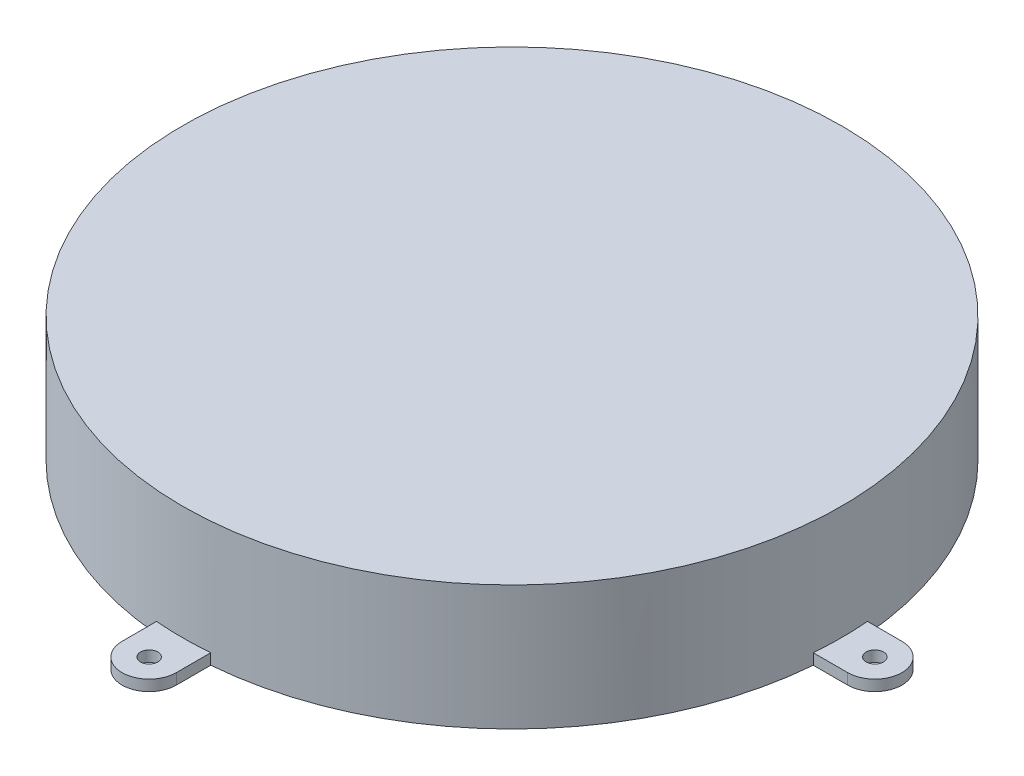
from build123d import *

# Parameters (mm, degrees)
SKETCH1_R           = 60.75
SKETCH1_R_2         = 59.75
BOSS_EXTRUDE1_DEPTH = 21
SKETCH2_R           = 60.75
BOSS_EXTRUDE2_DEPTH = 2
SKETCH3_R           = 1.6
BOSS_EXTRUDE3_DEPTH = 2


with BuildPart() as part:
    # Sketch1 → Boss-Extrude1 (new body)
    with BuildSketch(Plane(origin=(0, 0, 0), x_dir=(1, 0, 0), z_dir=(0, 1, 0))):
        with Locations(Location((0, 0, 0), (0, 0, 90))):
            Circle(SKETCH1_R)
        with Locations(Location((0, 0, 0), (0, 0, 90))):
            Circle(SKETCH1_R_2, mode=Mode.SUBTRACT)
    extrude(amount=BOSS_EXTRUDE1_DEPTH)

    # Sketch2 → Boss-Extrude2 (add)
    with BuildSketch(Plane(origin=(0, 21, 0), x_dir=(1, 0, 0), z_dir=(0, 1, 0))):
        with Locations(Location((0, 0, 0), (0, 0, 90))):
            Circle(SKETCH2_R)
    extrude(amount=BOSS_EXTRUDE2_DEPTH)

    # Sketch3 → Boss-Extrude3 (add)
    # profile 1 of 4: a face of its own
    with BuildSketch(Plane(origin=(0, 0, 0), x_dir=(1, 0, 0), z_dir=(0, 1, 0))):
        with BuildLine():
            Line((5, 66.893889039), (5, 60.543889039))
            Line((5, 60.543889039), (-5, 60.543889039))
            Line((-5, 60.543889039), (-5, 66.893889039))
            ThreePointArc((-5, 66.893889039), (0, 71.893889039), (5, 66.893889039))
        make_face()
        with Locations(Location((0, 66.893889039, 0), (0, 0, 270))):
            Circle(SKETCH3_R, mode=Mode.SUBTRACT)
    # profile 2 of 4: a face of its own
    with BuildSketch(Plane(origin=(0, 0, 0), x_dir=(1, 0, 0), z_dir=(0, 1, 0))):
        with BuildLine():
            Line((60.543889039, 5), (66.893889039, 5))
            ThreePointArc((66.893889039, 5), (71.893889039, 0), (66.893889039, -5))
            Line((66.893889039, -5), (60.543889039, -5))
            Line((60.543889039, -5), (60.543889039, 5))
        make_face()
        with Locations(Location((66.893889039, 0, 0), (0, 0, 270))):
            Circle(SKETCH3_R, mode=Mode.SUBTRACT)
    # profile 3 of 4: a face of its own
    with BuildSketch(Plane(origin=(0, 0, 0), x_dir=(1, 0, 0), z_dir=(0, 1, 0))):
        with BuildLine():
            Line((5, -60.543889039), (5, -66.893889039))
            ThreePointArc((5, -66.893889039), (0, -71.893889039), (-5, -66.893889039))
            Line((-5, -66.893889039), (-5, -60.543889039))
            Line((-5, -60.543889039), (5, -60.543889039))
        make_face()
        with Locations(Location((0, -66.893889039, 0), (0, 0, 270))):
            Circle(SKETCH3_R, mode=Mode.SUBTRACT)
    # profile 4 of 4: a face of its own
    with BuildSketch(Plane(origin=(0, 0, 0), x_dir=(1, 0, 0), z_dir=(0, 1, 0))):
        with BuildLine():
            Line((-60.543889039, -5), (-66.893889039, -5))
            ThreePointArc((-66.893889039, -5), (-71.893889039, 0), (-66.893889039, 5))
            Line((-66.893889039, 5), (-60.543889039, 5))
            Line((-60.543889039, 5), (-60.543889039, -5))
        make_face()
        with Locations(Location((-66.893889039, 0, 0), (0, 0, 270))):
            Circle(SKETCH3_R, mode=Mode.SUBTRACT)
    extrude(amount=BOSS_EXTRUDE3_DEPTH)


solid = part.part
